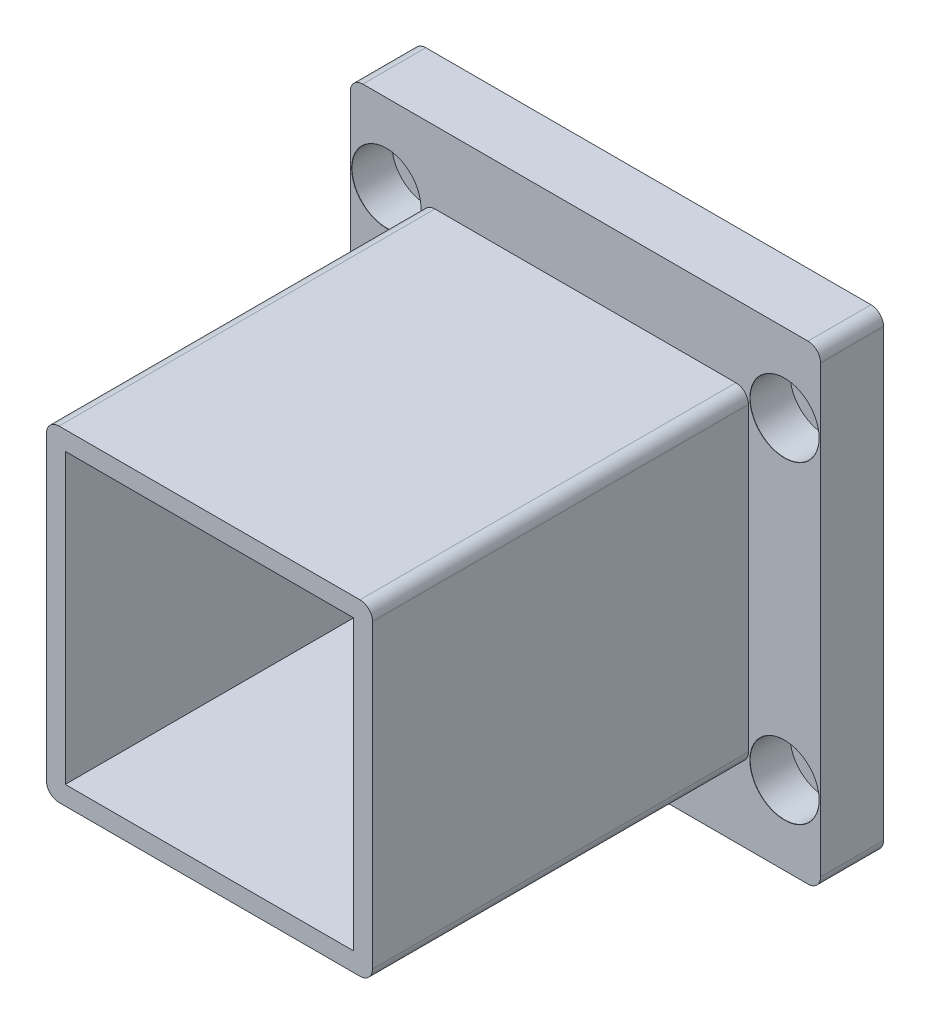
from build123d import *

# Parameters (mm, degrees)
SKETCH1_W                                    = 46
SKETCH1_H                                    = 46
BOSS_EXTRUDE1_DEPTH                          = 65
SKETCH3_W                                    = 75
SKETCH3_H                                    = 75
SKETCH3_W_2                                  = 52
SKETCH3_H_2                                  = 52
SKETCH3_W_3                                  = 23
SKETCH3_H_3                                  = 46
BOSS_EXTRUDE2_DEPTH                          = 5
SKETCH8_W                                    = 75
SKETCH8_H                                    = 75
SKETCH8_W_2                                  = 52
SKETCH8_H_2                                  = 52
BOSS_EXTRUDE3_DEPTH                          = 5.047079132
FILLET1_R                                    = 2
CBORE_FOR_M6_HEX_SOCKET_HEAD_CAP_SCR_2_COUNT = 2
CBORE_FOR_M6_HEX_SOCKET_HEAD_CAP_SCR_2_PITCH = 50
CBORE_FOR_M6_HEX_SOCKET_HEAD_CAP_SCR_3_COUNT = 2
CBORE_FOR_M6_HEX_SOCKET_HEAD_CAP_SCR_3_PITCH = 63.5
CBORE_FOR_M6_HEX_SOCKET_HEAD_CAP_SCR_4_COUNT = 2
CBORE_FOR_M6_HEX_SOCKET_HEAD_CAP_SCR_4_PITCH = 80.822336022


with BuildPart() as part:
    # Sketch1 → Boss-Extrude1 (new body)
    with BuildSketch(Plane(origin=(0, 0, 0), x_dir=(0, 1, 0), z_dir=(0, 0, 1))):
        Polygon((-26.156583063, 30.146094376), (-29.048003873, 30.146094376), (-29.048003873, -21.853905624), (22.951996127, -21.853905624), (22.951996127, 30.146094376), (15.339697873, 30.146094376), align=None)
        with Locations((-3.048003873, 4.146094376)):
            Rectangle(SKETCH1_W, SKETCH1_H, mode=Mode.SUBTRACT)
    extrude(amount=BOSS_EXTRUDE1_DEPTH)

    # Sketch3 → Boss-Extrude2 (add)
    # profile 1 of 5: a face of its own
    with BuildSketch(Plane(origin=(0, 0, 0), x_dir=(1, 0, 0), z_dir=(0, 0, -1))):
        with Locations((-4.146094376, 3.048003873)):
            Rectangle(SKETCH3_W, SKETCH3_H)
        with Locations((-4.146094376, 3.048003873)):
            Rectangle(SKETCH3_W_2, SKETCH3_H_2, mode=Mode.SUBTRACT)
    # profile 2 of 5: a face of its own
    with BuildSketch(Plane(origin=(0, 0, 0), x_dir=(1, 0, 0), z_dir=(0, 0, -1))):
        Polygon((21.853905624, 29.048003873), (-4.146094376, 29.048003873), (-4.146094376, 26.048003873), (18.853905624, 26.048003873), (18.853905624, -19.951996127), (-4.146094376, -19.951996127), (-4.146094376, -22.951996127), (21.853905624, -22.951996127), align=None)
    # profile 3 of 5: a face of its own
    with BuildSketch(Plane(origin=(0, 0, 0), x_dir=(1, 0, 0), z_dir=(0, 0, -1))):
        Polygon((-4.146094376, 26.048003873), (-4.146094376, 29.048003873), (-30.146094376, 29.048003873), (-30.146094376, -22.951996127), (-4.146094376, -22.951996127), (-4.146094376, -19.951996127), (-27.146094376, -19.951996127), (-27.146094376, 26.048003873), align=None)
    # profile 4 of 5: a face of its own
    with BuildSketch(Plane(origin=(0, 0, 0), x_dir=(1, 0, 0), z_dir=(0, 0, -1))):
        with Locations((7.353905624, 3.048003873)):
            Rectangle(SKETCH3_W_3, SKETCH3_H_3)
    # profile 5 of 5: a face of its own
    with BuildSketch(Plane(origin=(0, 0, 0), x_dir=(1, 0, 0), z_dir=(0, 0, -1))):
        with Locations((-15.646094376, 3.048003873)):
            Rectangle(SKETCH3_W_3, SKETCH3_H_3)
    extrude(amount=BOSS_EXTRUDE2_DEPTH)

    # Sketch8 → Boss-Extrude3 (add)
    with BuildSketch(Plane.XY):
        with Locations((-4.146094376, -3.048003873)):
            Rectangle(SKETCH8_W, SKETCH8_H)
        with Locations((-4.146094376, -3.048003873)):
            Rectangle(SKETCH8_W_2, SKETCH8_H_2, mode=Mode.SUBTRACT)
    extrude(amount=BOSS_EXTRUDE3_DEPTH)

    # Fillet1
    fillet1_edges = [part.edges().sort_by_distance(p)[0] for p in [
        (21.853905624, 22.951996127, 35.023539566),
        (21.853905624, -29.048003873, 35.023539566),
        (-30.146094376, -29.048003873, 35.023539566),
        (-30.146094376, 22.951996127, 35.023539566),
        (-41.646094376, -40.548003873, 0.023539566),
        (33.353905624, -40.548003873, 0.023539566),
        (33.353905624, 34.451996127, 0.023539566),
        (-41.646094376, 34.451996127, 0.023539566),
    ]]
    fillet(fillet1_edges, radius=FILLET1_R)

    # Sketch15 → CBORE for M6 Hex Socket Head Cap Screw2 (revolve, cut)
    with BuildSketch(Plane(origin=(-35.896094376, 21.951996127, 5.047079132), x_dir=(0, -1, 0), z_dir=(1, 0, 0))):
        Polygon((0, 0), (0, 10.047079132), (3.3, 10.047079132), (3.3, 6.4), (5.5, 6.4), (5.5, 0.025), (5.525, 0), align=None)
    cbore_for_m6_hex_socket_head_cap_screw2 = revolve(axis=Axis((-35.896094376, 21.951996127, 11.397079132), (0, 0, -1)), mode=Mode.SUBTRACT)

    # CBORE for M6 Hex Socket Head Cap Scr 2: CBORE for M6 Hex Socket Head Cap Screw2 ×2
    with Locations(*[(0, -i * CBORE_FOR_M6_HEX_SOCKET_HEAD_CAP_SCR_2_PITCH, 0) for i in range(1, CBORE_FOR_M6_HEX_SOCKET_HEAD_CAP_SCR_2_COUNT)]):
        add(cbore_for_m6_hex_socket_head_cap_screw2, mode=Mode.SUBTRACT)

    # CBORE for M6 Hex Socket Head Cap Scr 3: CBORE for M6 Hex Socket Head Cap Screw2 ×2
    with Locations(*[(i * CBORE_FOR_M6_HEX_SOCKET_HEAD_CAP_SCR_3_PITCH, 0, 0) for i in range(1, CBORE_FOR_M6_HEX_SOCKET_HEAD_CAP_SCR_3_COUNT)]):
        add(cbore_for_m6_hex_socket_head_cap_screw2, mode=Mode.SUBTRACT)

    # CBORE for M6 Hex Socket Head Cap Scr 4: CBORE for M6 Hex Socket Head Cap Screw2 ×2
    with Locations(*[Vector(0.7856739006278309, -0.6186408666360874, 0) * (i * CBORE_FOR_M6_HEX_SOCKET_HEAD_CAP_SCR_4_PITCH) for i in range(1, CBORE_FOR_M6_HEX_SOCKET_HEAD_CAP_SCR_4_COUNT)]):
        add(cbore_for_m6_hex_socket_head_cap_screw2, mode=Mode.SUBTRACT)


solid = part.part
